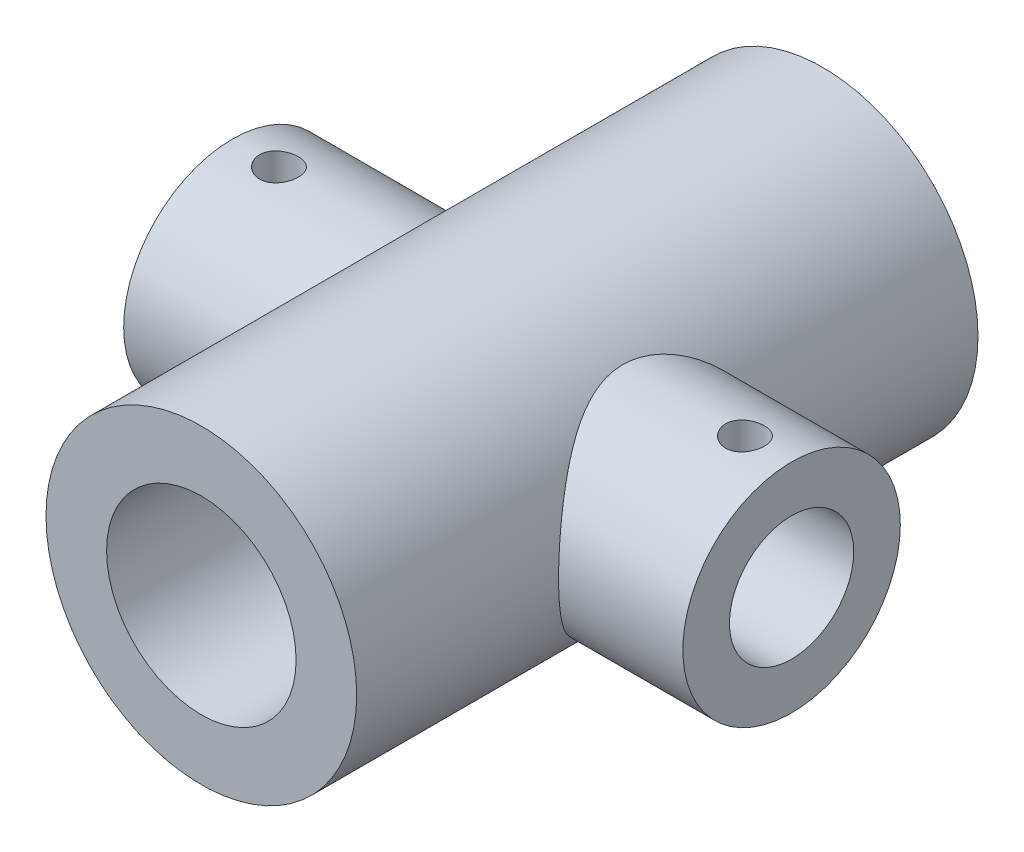
from build123d import *

# Parameters (mm, degrees)
SKETCH1_R                = 10
SKETCH1_R_2              = 6.1
BOSS_EXTRUDE1_DEPTH      = 20
BOSS_EXTRUDE2_REACH      = 37.833
BOSS_EXTRUDE2_END_RADIUS = 10
SKETCH3_R                = 7
SKETCH3_R_2              = 4
M3_TAPPED_HOLE2_D        = 2.5
M3_TAPPED_HOLE2_DEPTH    = 8.5
M3_TAPPED_HOLE2_TIP      = 0.751075774


with BuildPart() as part:
    # Sketch1 → Boss-Extrude1 (new, symmetric)
    with BuildSketch(Plane.XY):
        Circle(SKETCH1_R)
        Circle(SKETCH1_R_2, mode=Mode.SUBTRACT)
    extrude(amount=BOSS_EXTRUDE1_DEPTH, both=True)

    # Boss-Extrude2: up to this cylinder (the profile starts outside it)
    boss_extrude2_end = Plane(origin=(0, 0, 6.80201), z_dir=(0, 0, -1)) * Cylinder(BOSS_EXTRUDE2_END_RADIUS, 96.666, mode=Mode.PRIVATE)
    # Sketch3 → Boss-Extrude2 (add, up to the surface)
    with BuildSketch(Plane(origin=(18, 0, 0), x_dir=(0, 0, -1), z_dir=(1, 0, 0)), mode=Mode.PRIVATE) as boss_extrude2_sk1:
        Circle(SKETCH3_R)
        Circle(SKETCH3_R_2, mode=Mode.SUBTRACT)
    boss_extrude2_tool1 = extrude(boss_extrude2_sk1.sketch, amount=-BOSS_EXTRUDE2_REACH, mode=Mode.PRIVATE) - boss_extrude2_end
    boss_extrude2 = boss_extrude2_tool1.solids().sort_by_distance((18, 0, 6.80201))[0]
    add(boss_extrude2)

    # Mirror2: Boss-Extrude2 across plane
    add(boss_extrude2.mirror(Plane(origin=(0, 0, 0), x_dir=(0, 0, 1), z_dir=(1, 0, 0))))

    # M3 Tapped Hole2
    with Locations(Plane(origin=(0, 7, 0), x_dir=(1, 0, 0), z_dir=(0, 1, 0))):
        with Locations((-15, 0), (15, 0)):
            Hole(M3_TAPPED_HOLE2_D / 2, depth=M3_TAPPED_HOLE2_DEPTH)
            with Locations((0, 0, -(M3_TAPPED_HOLE2_DEPTH + M3_TAPPED_HOLE2_TIP / 2))):  # 118° drill point
                Cone(0, M3_TAPPED_HOLE2_D / 2, M3_TAPPED_HOLE2_TIP, mode=Mode.SUBTRACT)


solid = part.part
